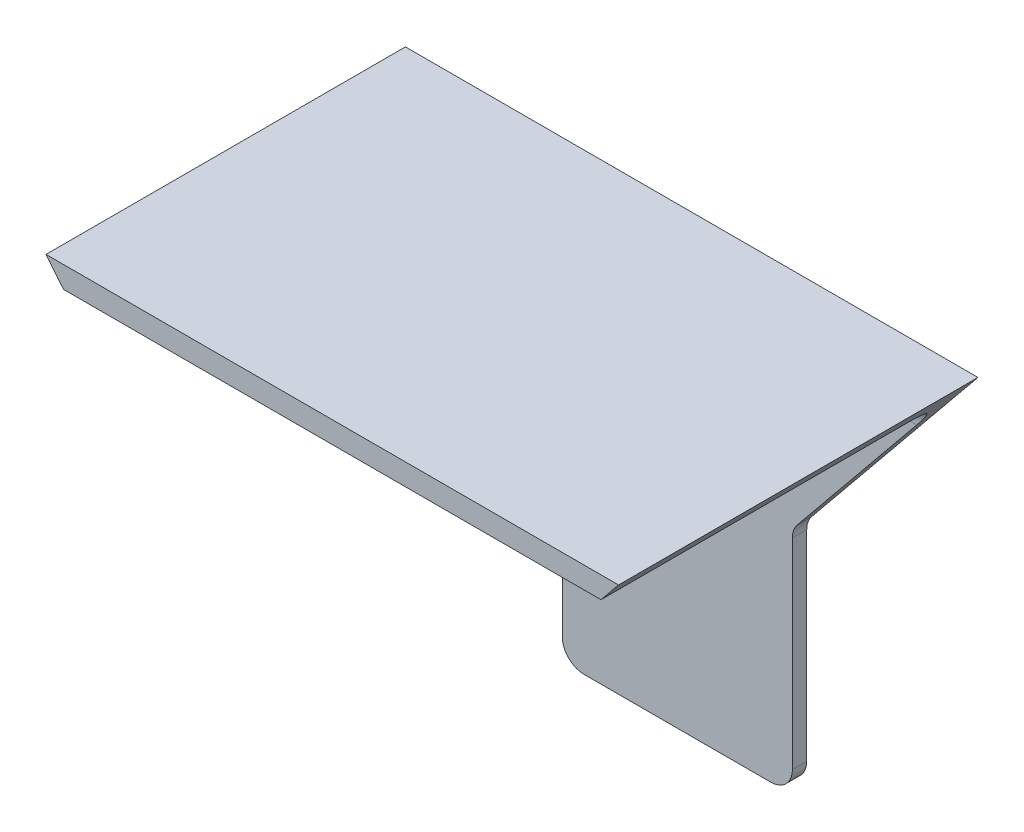
from build123d import *

# Parameters (mm, degrees)
SIDE_EXTRUDE_DEPTH         = 2
TOP_EXTRUDE_DEPTH          = 48
FILLET_BETWEEN_SIDES_5MM_R = 5


with BuildPart() as part:
    # Sketch1 → Side extrude (new body)
    with BuildSketch(Plane.XY.offset(55.601550083)):
        with BuildLine():
            Line((93.845211173, 26.628512047), (21.944630571, 26.628512047))
            Line((21.944630571, 26.628512047), (18.071324489, 26.628512047))
            Line((18.071324489, 26.628512047), (41.218517255, -1.714989299))
            ThreePointArc((41.218517255, -1.714989299), (41.720764918, -2.60531677), (41.894920872, -3.612593011))
            Line((41.894920872, -3.612593011), (41.894920872, -31.543238626))
            ThreePointArc((41.894920872, -31.543238626), (42.773600528, -33.66455897), (44.894920872, -34.543238626))
            Line((44.894920872, -34.543238626), (70.894920872, -34.543238626))
            ThreePointArc((70.894920872, -34.543238626), (73.016241216, -33.66455897), (73.894920872, -31.543238626))
            Line((73.894920872, -31.543238626), (73.894920872, -3.612593011))
            ThreePointArc((73.894920872, -3.612593011), (74.069076826, -2.60531677), (74.571324489, -1.714989299))
            Line((74.571324489, -1.714989299), (97.718517255, 26.628512047))
            Line((97.718517255, 26.628512047), (93.845211173, 26.628512047))
        make_face()
    extrude(amount=SIDE_EXTRUDE_DEPTH)

    # Sketch2 → Top extrude (add)
    with BuildSketch(Plane.XY.offset(57.601550083)):
        Polygon((97.718517255, 26.628512047), (18.071324489, 26.628512047), (20.521324489, 23.628512047), (95.268517255, 23.628512047), align=None)
    extrude(amount=TOP_EXTRUDE_DEPTH)

    # Fillet between sides 5mm
    fillet_between_sides_5mm_edges = [part.edges().sort_by_distance(p)[0] for p in [
        (57.894920872, 23.628512047, 57.601550083),
    ]]
    fillet(fillet_between_sides_5mm_edges, radius=FILLET_BETWEEN_SIDES_5MM_R)


solid = part.part
